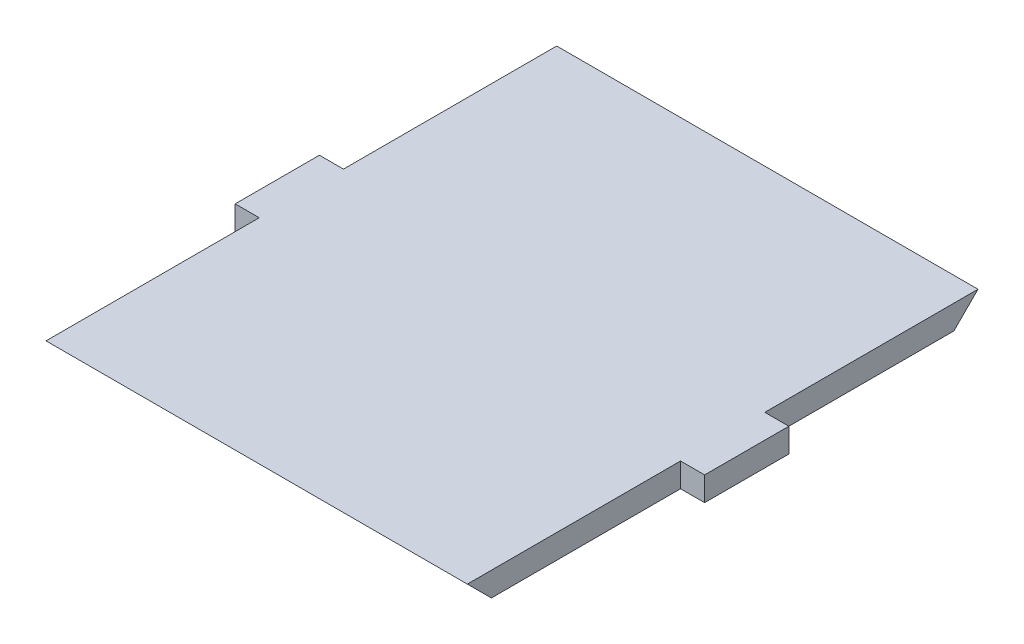
from build123d import *

# Parameters (mm, degrees)
SKETCH1_W           = 2
SKETCH1_H           = 7
SKETCH1_W_2         = 35
SKETCH1_H_2         = 42.42640687
BOSS_EXTRUDE1_DEPTH = 2
CUT_EXTRUDE1_DEPTH  = 43.995801746


with BuildPart() as part:
    # Sketch1 → Boss-Extrude1 (new body)
    with BuildSketch(Plane(origin=(0, 0, 0), x_dir=(1, 0, 0), z_dir=(0, 1, 0))):
        with Locations((-7.400304625, 0.597741848)):
            Rectangle(SKETCH1_W, SKETCH1_H)
        with Locations((11.099695375, 0.595945283)):
            Rectangle(SKETCH1_W_2, SKETCH1_H_2)
        with Locations((29.599695375, 0.597741848)):
            Rectangle(SKETCH1_W, SKETCH1_H)
    extrude(amount=BOSS_EXTRUDE1_DEPTH)

    # Sketch2 → Cut-Extrude1 (cut, through all)
    with BuildSketch(Plane(origin=(28.599695375, 0, 0), x_dir=(0, 0, -1), z_dir=(1, 0, 0))):
        Polygon((-20.617258152, 2), (-18.617258152, 0), (-20.617258152, 0), align=None)
        Polygon((21.809148718, 2), (21.809148718, 0), (19.809148718, 0), align=None)
    extrude(amount=-CUT_EXTRUDE1_DEPTH, mode=Mode.SUBTRACT)


solid = part.part
